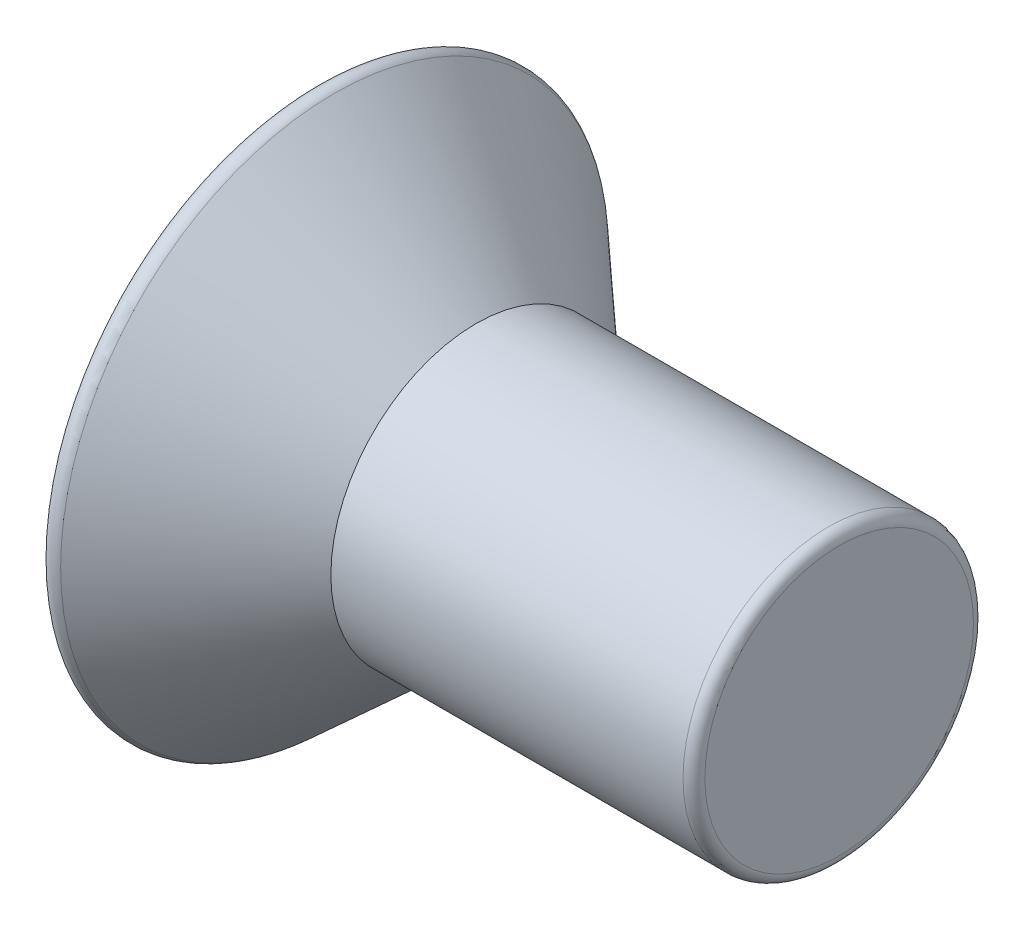
from build123d import *

# Parameters (mm, degrees)
KES_EKSTR_ZYON1_DEPTH = 5
RADYUS2_R             = 0.3


with BuildPart() as part:
    # Çizim1 → Döndür1 (revolve)
    with BuildSketch(Plane.XY, mode=Mode.PRIVATE) as d_nd_r1_sk:
        Polygon((0, 0), (0, 4), (-10, 4), (-14.4, 8), (-14.4, 0), align=None)
    revolve(d_nd_r1_sk.sketch.rotate(Axis((-14.4, 0, 0), (1, 0, 0)), 90), axis=Axis((-14.4, 0, 0), (1, 0, 0)))

    # Çizim2 → Kes-Ekstrüzyon1 (cut)
    with BuildSketch(Plane.ZY.offset(14.4)):
        Polygon((2.886751346, 0), (1.443375673, 2.5), (-1.443375673, 2.5), (-2.886751346, 0), (-1.443375673, -2.5), (1.443375673, -2.5), align=None)
    extrude(amount=-KES_EKSTR_ZYON1_DEPTH, mode=Mode.SUBTRACT)

    # Radyus2
    radyus2_edges = [part.edges().sort_by_distance(p)[0] for p in [
        (-14.4, 0, -8),
        (0, 0, -4),
    ]]
    fillet(radyus2_edges, radius=RADYUS2_R)


solid = part.part
